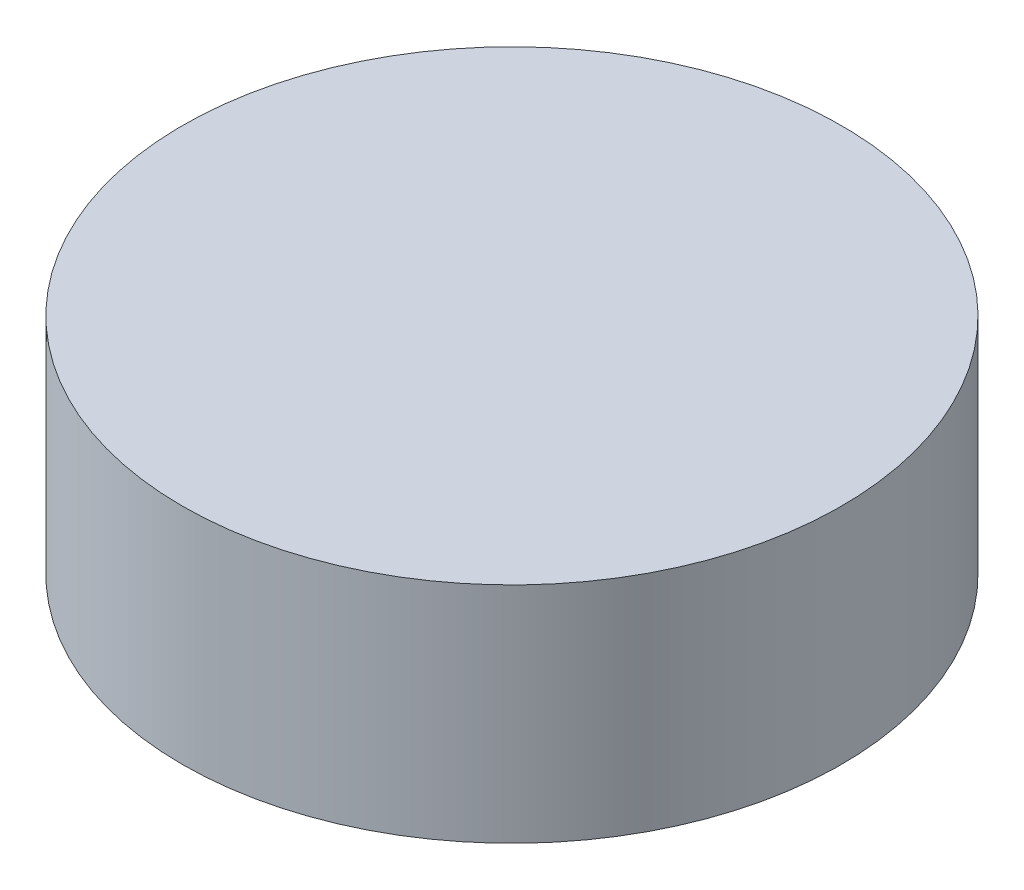
from build123d import *

# Parameters (mm, degrees)
SKETCH1_R           = 44.184440045
BOSS_EXTRUDE1_DEPTH = 30


with BuildPart() as part:
    # Sketch1 → Boss-Extrude1 (new body)
    with BuildSketch(Plane(origin=(0, 0, 0), x_dir=(1, 0, 0), z_dir=(0, 1, 0))):
        with Locations(Location((0, 0, 0), (0, 0, 270))):
            Circle(SKETCH1_R)
    extrude(amount=BOSS_EXTRUDE1_DEPTH)


solid = part.part
